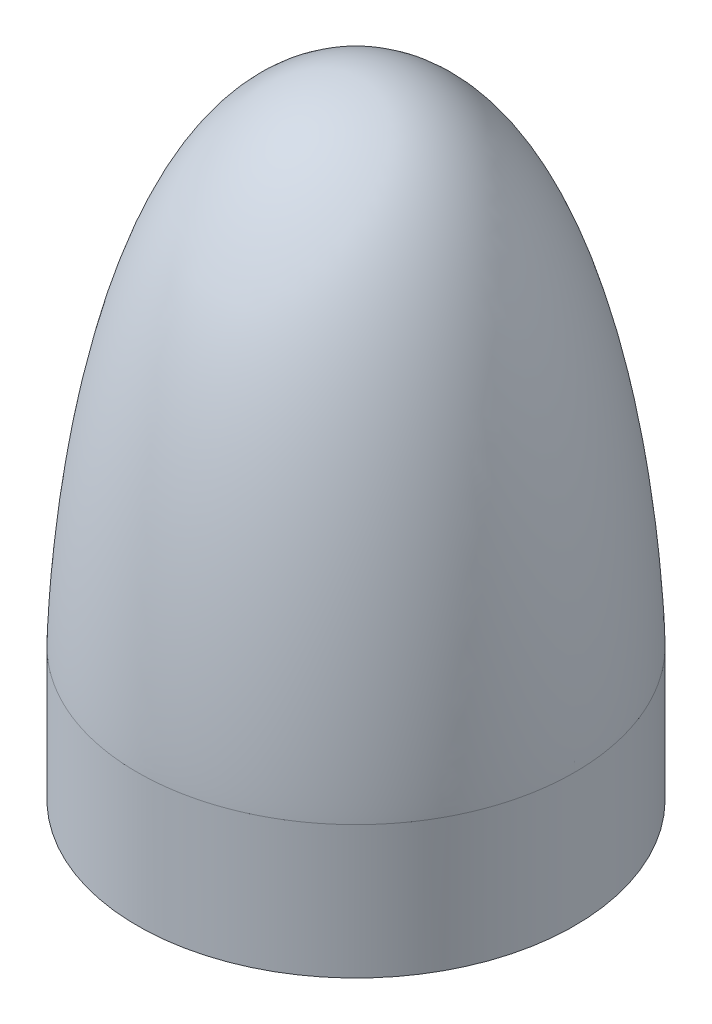
from build123d import *

# Parameters (mm, degrees)
SCALE2_SCALE = 2


with BuildPart() as part:
    # Sketch1 → Revolve1 (revolve)
    with BuildSketch(Plane.XY, mode=Mode.PRIVATE) as revolve1_sk:
        with BuildLine():
            Line((7, 4.256292026), (7, 0))
            Line((7, 0), (0, 0))
            Line((0, 0), (0, 20))
            add(Edge.make_bspline(
                [(0, 20), (6.748759859, 19.983290112), (7.005059619, 4.256663996), (7, 4.256292026)],
                knots=[0, 0, 0, 0, 0.166417438, 0.166417438, 0.166417438, 0.166417438], degree=3))
        make_face()
    revolve(revolve1_sk.sketch.rotate(Axis((0, 0, 0), (0, 1, 0)), 90), axis=Axis((0, 0, 0), (0, 1, 0)))


with BuildPart() as part_1:
    # Scale2: scaled about (0, 7.913014441, 0)
    add(part.part.scale(SCALE2_SCALE).moved(Location((0, -7.913014441, 0))))


solid = part_1.part
